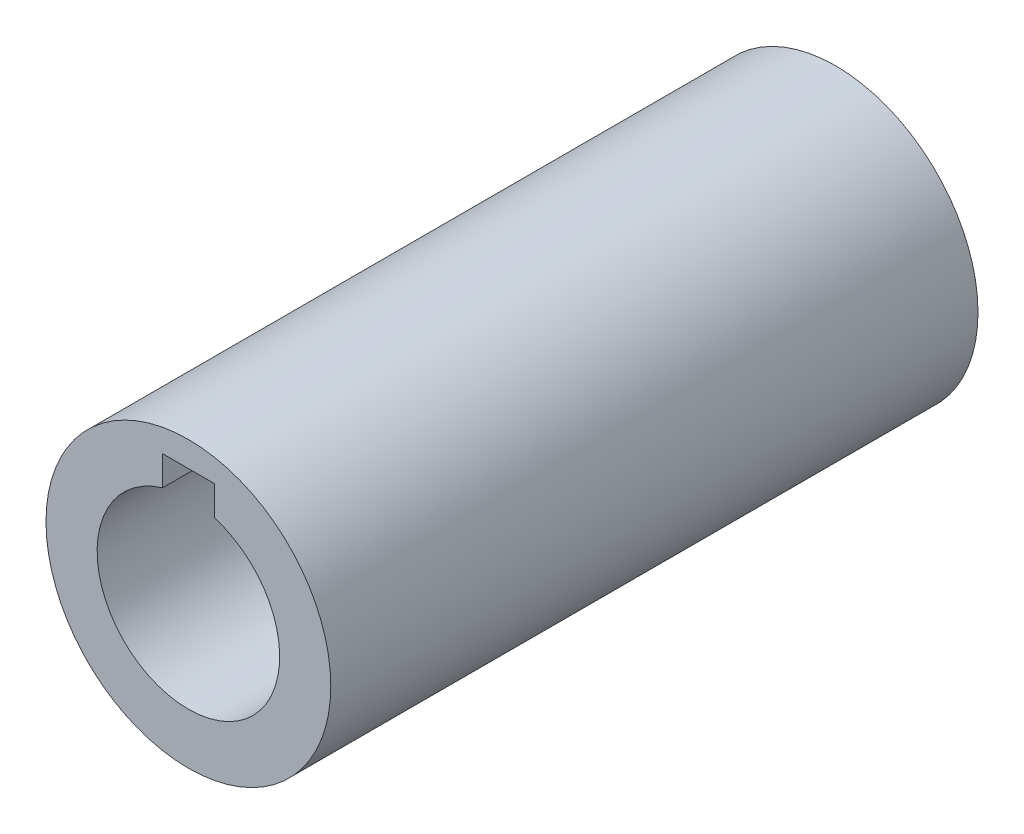
from build123d import *

# Parameters (mm, degrees)
SKETCH1_R           = 22
SKETCH1_R_2         = 14.1
BOSS_EXTRUDE1_DEPTH = 100
CUT_EXTRUDE1_DEPTH  = 105.728219693


with BuildPart() as part:
    # Sketch1 → Boss-Extrude1 (new body)
    with BuildSketch(Plane.XY):
        Circle(SKETCH1_R)
        Circle(SKETCH1_R_2, mode=Mode.SUBTRACT)
    extrude(amount=BOSS_EXTRUDE1_DEPTH)

    # Sketch2 → Cut-Extrude1 (cut, through all)
    with BuildSketch(Plane(origin=(0, 0, 0), x_dir=(-1, 0, 0), z_dir=(0, 0, -1))):
        Polygon((0, 18.1), (4, 18.1), (4, 12.1), (-4, 12.1), (-4, 18.1), align=None)
    extrude(amount=-CUT_EXTRUDE1_DEPTH, mode=Mode.SUBTRACT)


solid = part.part
